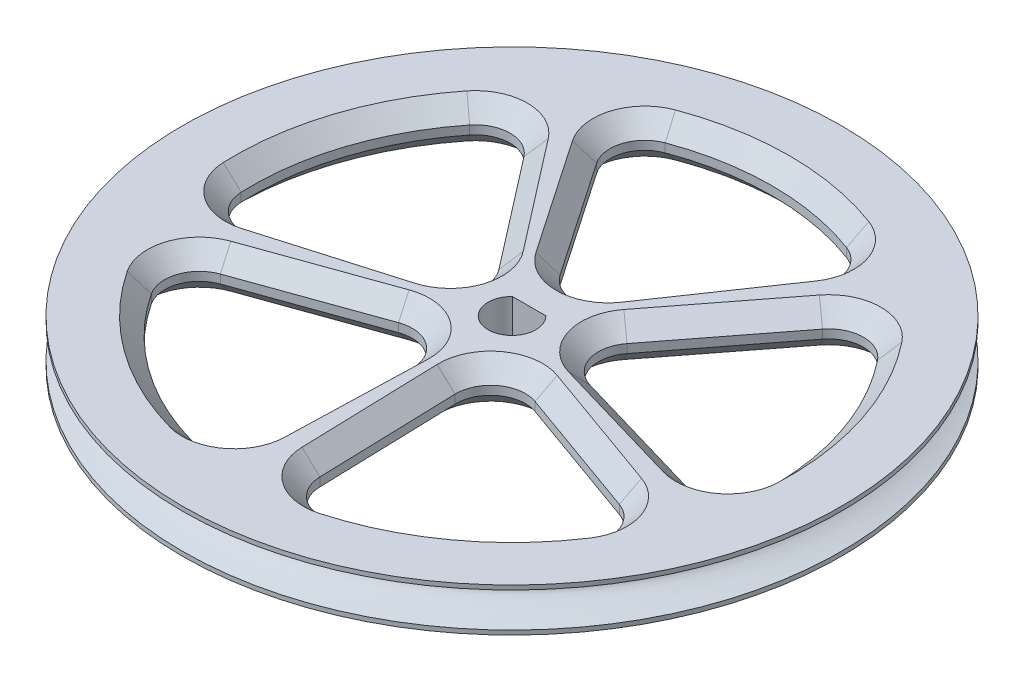
from build123d import *

# Parameters (mm, degrees)
SKETCH1_R           = 24.13
BOSS_EXTRUDE1_DEPTH = 3.175
CUT_EXTRUDE2_DEPTH  = 35.272356572
CHAMFER2_SIZE       = 1.27
CUT_EXTRUDE4_DEPTH  = 3.175


with BuildPart() as part:
    # Sketch1 → Boss-Extrude1 (new body)
    with BuildSketch(Plane(origin=(0, 0, 0), x_dir=(1, 0, 0), z_dir=(0, 1, 0))):
        with Locations(Location((0, 0, 0), (0, 0, 270))):
            Circle(SKETCH1_R)
    extrude(amount=BOSS_EXTRUDE1_DEPTH)

    # Sketch3 → Cut-Extrude2 (cut, through all)
    with BuildSketch(Plane(origin=(0, 3.175, 0), x_dir=(1, 0, 0), z_dir=(0, 1, 0))):
        with BuildLine():
            Line((-7.850343046, 14.0437682), (-2.098034552, 5.614426559))
            ThreePointArc((-2.098034552, 5.614426559), (0, 4.506156638), (2.098034552, 5.614426559))
            Line((2.098034552, 5.614426559), (7.850343046, 14.0437682))
            ThreePointArc((7.850343046, 14.0437682), (8.172745173, 16.245619231), (6.637279032, 17.856344168))
            ThreePointArc((6.637279032, 17.856344168), (0, 19.05), (-6.637279032, 17.856344168))
            ThreePointArc((-6.637279032, 17.856344168), (-8.172745173, 16.245619231), (-7.850343046, 14.0437682))
        make_face()
        with BuildLine():
            Line((10.930527847, 11.805882948), (4.691308633, 3.730302652))
            ThreePointArc((4.691308633, 3.730302652), (4.285609634, 1.392478981), (5.987965296, -0.260396211))
            Line((5.987965296, -0.260396211), (15.782306673, -3.12635687))
            ThreePointArc((15.782306673, -3.12635687), (17.976019181, -2.752570127), (19.033424496, -0.794513668))
            ThreePointArc((19.033424496, -0.794513668), (18.117626635, 5.886773743), (14.931360461, 11.830341279))
            ThreePointArc((14.931360461, 11.830341279), (12.924984882, 12.79291498), (10.930527847, 11.805882948))
        make_face()
        with BuildLine():
            Line((14.60578077, -6.747331271), (4.997422739, -3.308972732))
            ThreePointArc((4.997422739, -3.308972732), (2.648652417, -3.6455573), (1.602731524, -5.775360269))
            Line((1.602731524, -5.775360269), (1.903658899, -15.975963007))
            ThreePointArc((1.903658899, -15.975963007), (2.937045662, -17.946801126), (5.126024229, -18.34738062))
            ThreePointArc((5.126024229, -18.34738062), (11.197309056, -15.411773743), (15.865367295, -10.544791159))
            ThreePointArc((15.865367295, -10.544791159), (16.160825135, -8.339162959), (14.60578077, -6.747331271))
        make_face()
        with BuildLine():
            Line((-1.903658899, -15.975963007), (-1.602731524, -5.775360269))
            ThreePointArc((-1.602731524, -5.775360269), (-2.648652417, -3.6455573), (-4.997422739, -3.308972732))
            Line((-4.997422739, -3.308972732), (-14.60578077, -6.747331271))
            ThreePointArc((-14.60578077, -6.747331271), (-16.160825135, -8.339162959), (-15.865367295, -10.544791159))
            ThreePointArc((-15.865367295, -10.544791159), (-11.197309056, -15.411773743), (-5.126024229, -18.34738062))
            ThreePointArc((-5.126024229, -18.34738062), (-2.937045662, -17.946801126), (-1.903658899, -15.975963007))
        make_face()
        with BuildLine():
            Line((-15.782306673, -3.12635687), (-5.987965296, -0.260396211))
            ThreePointArc((-5.987965296, -0.260396211), (-4.285609634, 1.392478981), (-4.691308633, 3.730302652))
            Line((-4.691308633, 3.730302652), (-10.930527847, 11.805882948))
            ThreePointArc((-10.930527847, 11.805882948), (-12.924984882, 12.79291498), (-14.931360461, 11.830341279))
            ThreePointArc((-14.931360461, 11.830341279), (-18.117626635, 5.886773743), (-19.033424496, -0.794513668))
            ThreePointArc((-19.033424496, -0.794513668), (-17.976019181, -2.752570127), (-15.782306673, -3.12635687))
        make_face()
    extrude(amount=-CUT_EXTRUDE2_DEPTH, mode=Mode.SUBTRACT)

    # Chamfer2
    chamfer2_edges = [part.edges().sort_by_distance(p)[0] for p in [
        (0, 0, -4.506156638),
        (-4.974188799, 0, -9.82909738),
        (-8.172745173, 0, -16.245619231),
        (0, 0, -19.05),
        (8.172745173, 0, -16.245619231),
        (4.974188799, 0, -9.82909738),
        (0, 3.175, -4.506156638),
        (4.974188799, 3.175, -9.82909738),
        (8.172745173, 3.175, -16.245619231),
        (0, 3.175, -19.05),
        (-8.172745173, 3.175, -16.245619231),
        (-4.974188799, 3.175, -9.82909738),
        (4.285609634, 0, -1.392478981),
        (7.81091824, 0, -7.7680928),
        (12.924984882, 0, -12.79291498),
        (18.117626635, 0, -5.886773743),
        (17.976019181, 0, 2.752570127),
        (10.885135984, 0, 1.693376541),
        (4.285609634, 3.175, -1.392478981),
        (10.885135984, 3.175, 1.693376541),
        (17.976019181, 3.175, 2.752570127),
        (18.117626635, 3.175, -5.886773743),
        (12.924984882, 3.175, -12.79291498),
        (7.81091824, 3.175, -7.7680928),
        (2.648652417, 0, 3.6455573),
        (9.801601755, 0, 5.028152001),
        (16.160825135, 0, 8.339162959),
        (11.197309056, 0, 15.411773743),
        (2.937045662, 0, 17.946801126),
        (1.753195212, 0, 10.875661638),
        (2.648652417, 3.175, 3.6455573),
        (1.753195212, 3.175, 10.875661638),
        (2.937045662, 3.175, 17.946801126),
        (11.197309056, 3.175, 15.411773743),
        (16.160825135, 3.175, 8.339162959),
        (9.801601755, 3.175, 5.028152001),
        (-2.648652417, 0, 3.6455573),
        (-1.753195212, 0, 10.875661638),
        (-2.937045662, 0, 17.946801126),
        (-11.197309056, 0, 15.411773743),
        (-16.160825135, 0, 8.339162959),
        (-9.801601755, 0, 5.028152001),
        (-2.648652417, 3.175, 3.6455573),
        (-9.801601755, 3.175, 5.028152001),
        (-16.160825135, 3.175, 8.339162959),
        (-11.197309056, 3.175, 15.411773743),
        (-2.937045662, 3.175, 17.946801126),
        (-1.753195212, 3.175, 10.875661638),
        (-4.285609634, 0, -1.392478981),
        (-10.885135984, 0, 1.693376541),
        (-17.976019181, 0, 2.752570127),
        (-18.117626635, 0, -5.886773743),
        (-12.924984882, 0, -12.79291498),
        (-7.81091824, 0, -7.7680928),
        (-4.285609634, 3.175, -1.392478981),
        (-7.81091824, 3.175, -7.7680928),
        (-12.924984882, 3.175, -12.79291498),
        (-18.117626635, 3.175, -5.886773743),
        (-17.976019181, 3.175, 2.752570127),
        (-10.885135984, 3.175, 1.693376541),
    ]]
    chamfer(chamfer2_edges, length=CHAMFER2_SIZE)

    # Sketch6 → Cut-Revolve3 (revolve, cut)
    with BuildSketch(Plane(origin=(0, 0, 0), x_dir=(0, 0, -1), z_dir=(1, 0, 0))):
        with BuildLine():
            Line((-24.13, 2.8575), (-24.13, 0.3175))
            add(Edge.make_bspline(
                [(-24.13, 2.8575), (-20.066, 1.5875), (-24.13, 0.3175)],
                knots=[0, 0, 0, 1, 1, 1], degree=2))
        make_face()
    revolve(axis=Axis((0, 5.876661269, 0), (0, -1, 0)), mode=Mode.SUBTRACT)

    # Sketch2 → Cut-Extrude4 (cut)
    with BuildSketch(Plane(origin=(0, 3.175, 0), x_dir=(1, 0, 0), z_dir=(0, 1, 0))):
        with BuildLine():
            Line((-1.224744914, 1.250000048), (1.224744914, 1.250000048))
            ThreePointArc((1.224744914, 1.250000048), (0, -1.750000064), (-1.224744914, 1.250000048))
        make_face()
    extrude(amount=-CUT_EXTRUDE4_DEPTH, mode=Mode.SUBTRACT)


solid = part.part
